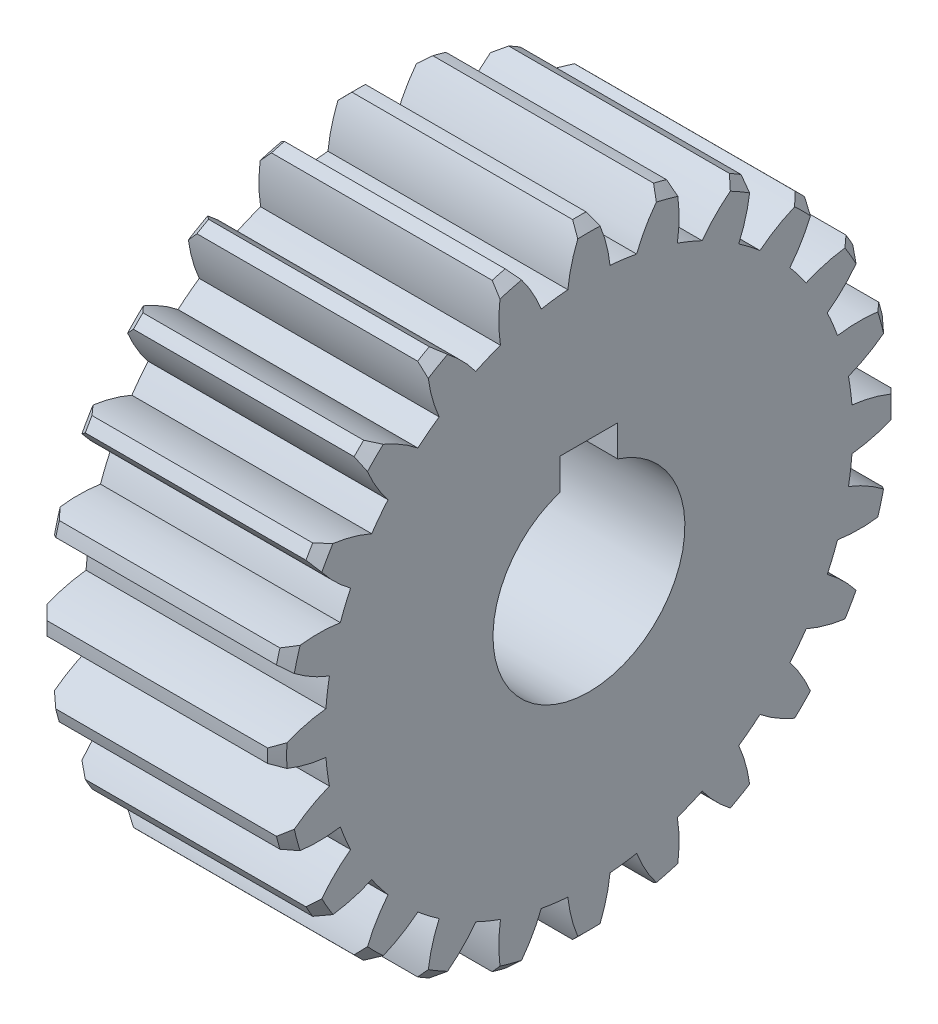
from build123d import *

# Parameters (mm, degrees)
SKETCH2_W          = 25
SKETCH2_H          = 22.5
CHAMFER1_SIZE      = 1
SKETCH3_W          = 6
SKETCH3_H          = 4.562916494
CUT_EXTRUDE1_DEPTH = 56


with BuildPart() as part:
    # Sketch2 → Revolve1 (revolve)
    with BuildSketch(Plane.XY, mode=Mode.PRIVATE) as revolve1_sk:
        with Locations((12.5, 21.25)):
            Rectangle(SKETCH2_W, SKETCH2_H)
    revolve(revolve1_sk.sketch.rotate(Axis((80.219330275, 0, 0), (-1, 0, 0)), 90), axis=Axis((80.219330275, 0, 0), (-1, 0, 0)))

    # Chamfer1
    chamfer1_edges = [part.edges().sort_by_distance(p)[0] for p in [
        (0, 0, 32.5),
        (25, 0, 32.5),
    ]]
    chamfer(chamfer1_edges, length=CHAMFER1_SIZE)

    # Sketch3 → Cut-Extrude1 (cut)
    with BuildSketch(Plane.ZY):
        with Locations((0, 10.518541753)):
            Rectangle(SKETCH3_W, SKETCH3_H)
        with BuildLine():
            ThreePointArc((9.08581572, 31.204133583), (9.38841269, 28.562236263), (9.219747923, 25.908420412))
            ThreePointArc((9.219747923, 25.908420412), (10.52379439, 25.406687144), (11.800673485, 24.83936604))
            ThreePointArc((11.800673485, 24.83936604), (13.55794067, 26.835161225), (15.640012549, 28.489296366))
            ThreePointArc((15.640012549, 28.489296366), (12.437211552, 30.026084807), (9.08581572, 31.204133583))
        make_face()
        with BuildLine():
            ThreePointArc((0.7, 32.492460664), (1.676059569, 30.01890167), (2.2, 27.411858748))
            ThreePointArc((2.2, 27.411858748), (3.589470286, 27.264733688), (4.969674288, 27.04722421))
            ThreePointArc((4.969674288, 27.04722421), (6.150514241, 29.429828538), (7.733519564, 31.566480247))
            ThreePointArc((7.733519564, 31.566480247), (4.242101247, 32.221957995), (0.7, 32.492460664))
        make_face()
        with BuildLine():
            ThreePointArc((16.852448115, 27.789296366), (16.460961, 25.159101656), (15.611185262, 22.63936604))
            ThreePointArc((15.611185262, 22.63936604), (16.740939298, 21.817216858), (17.827476287, 20.938746124))
            ThreePointArc((17.827476287, 20.938746124), (20.041415848, 22.411722022), (22.480664526, 23.47061402))
            ThreePointArc((22.480664526, 23.47061402), (19.784746443, 25.783983559), (16.852448115, 27.789296366))
        make_face()
        with BuildLine():
            ThreePointArc((23.47061402, 22.480664526), (22.411722022, 20.041415848), (20.938746124, 17.827476287))
            ThreePointArc((20.938746124, 17.827476287), (21.817216858, 16.740939298), (22.63936604, 15.611185262))
            ThreePointArc((22.63936604, 15.611185262), (25.159101656, 16.460961), (27.789296366, 16.852448115))
            ThreePointArc((27.789296366, 16.852448115), (25.783983559, 19.784746443), (23.47061402, 22.480664526))
        make_face()
        with BuildLine():
            ThreePointArc((28.489296366, 15.640012549), (26.835161225, 13.55794067), (24.83936604, 11.800673485))
            ThreePointArc((24.83936604, 11.800673485), (25.406687144, 10.52379439), (25.908420412, 9.219747923))
            ThreePointArc((25.908420412, 9.219747923), (28.562236263, 9.38841269), (31.204133583, 9.08581572))
            ThreePointArc((31.204133583, 9.08581572), (30.026084807, 12.437211552), (28.489296366, 15.640012549))
        make_face()
        with BuildLine():
            ThreePointArc((31.566480247, 7.733519564), (29.429828538, 6.150514241), (27.04722421, 4.969674288))
            ThreePointArc((27.04722421, 4.969674288), (27.264733688, 3.589470286), (27.411858748, 2.2))
            ThreePointArc((27.411858748, 2.2), (30.01890167, 1.676059569), (32.492460664, 0.7))
            ThreePointArc((32.492460664, 0.7), (32.221957995, 4.242101247), (31.566480247, 7.733519564))
        make_face()
        with BuildLine():
            ThreePointArc((32.492460664, -0.7), (30.01890167, -1.676059569), (27.411858748, -2.2))
            ThreePointArc((27.411858748, -2.2), (27.264733688, -3.589470286), (27.04722421, -4.969674288))
            ThreePointArc((27.04722421, -4.969674288), (29.429828538, -6.150514241), (31.566480247, -7.733519564))
            ThreePointArc((31.566480247, -7.733519564), (32.221957995, -4.242101247), (32.492460664, -0.7))
        make_face()
        with BuildLine():
            ThreePointArc((31.204133583, -9.08581572), (28.562236263, -9.38841269), (25.908420412, -9.219747923))
            ThreePointArc((25.908420412, -9.219747923), (25.406687144, -10.52379439), (24.83936604, -11.800673485))
            ThreePointArc((24.83936604, -11.800673485), (26.835161225, -13.55794067), (28.489296366, -15.640012549))
            ThreePointArc((28.489296366, -15.640012549), (30.026084807, -12.437211552), (31.204133583, -9.08581572))
        make_face()
        with BuildLine():
            ThreePointArc((27.789296366, -16.852448115), (25.159101656, -16.460961), (22.63936604, -15.611185262))
            ThreePointArc((22.63936604, -15.611185262), (21.817216858, -16.740939298), (20.938746124, -17.827476287))
            ThreePointArc((20.938746124, -17.827476287), (22.411722022, -20.041415848), (23.47061402, -22.480664526))
            ThreePointArc((23.47061402, -22.480664526), (25.783983559, -19.784746443), (27.789296366, -16.852448115))
        make_face()
        with BuildLine():
            ThreePointArc((22.480664526, -23.47061402), (20.041415848, -22.411722022), (17.827476287, -20.938746124))
            ThreePointArc((17.827476287, -20.938746124), (16.740939298, -21.817216858), (15.611185262, -22.63936604))
            ThreePointArc((15.611185262, -22.63936604), (16.460961, -25.159101656), (16.852448115, -27.789296366))
            ThreePointArc((16.852448115, -27.789296366), (19.784746443, -25.783983559), (22.480664526, -23.47061402))
        make_face()
        with BuildLine():
            ThreePointArc((15.640012549, -28.489296366), (13.55794067, -26.835161225), (11.800673485, -24.83936604))
            ThreePointArc((11.800673485, -24.83936604), (10.52379439, -25.406687144), (9.219747923, -25.908420412))
            ThreePointArc((9.219747923, -25.908420412), (9.38841269, -28.562236263), (9.08581572, -31.204133583))
            ThreePointArc((9.08581572, -31.204133583), (12.437211552, -30.026084807), (15.640012549, -28.489296366))
        make_face()
        with BuildLine():
            ThreePointArc((7.733519564, -31.566480247), (6.150514241, -29.429828538), (4.969674288, -27.04722421))
            ThreePointArc((4.969674288, -27.04722421), (3.589470286, -27.264733688), (2.2, -27.411858748))
            ThreePointArc((2.2, -27.411858748), (1.676059569, -30.01890167), (0.7, -32.492460664))
            ThreePointArc((0.7, -32.492460664), (4.242101247, -32.221957995), (7.733519564, -31.566480247))
        make_face()
        with BuildLine():
            ThreePointArc((-0.7, -32.492460664), (-1.676059569, -30.01890167), (-2.2, -27.411858748))
            ThreePointArc((-2.2, -27.411858748), (-3.589470286, -27.264733688), (-4.969674288, -27.04722421))
            ThreePointArc((-4.969674288, -27.04722421), (-6.150514241, -29.429828538), (-7.733519564, -31.566480247))
            ThreePointArc((-7.733519564, -31.566480247), (-4.242101247, -32.221957995), (-0.7, -32.492460664))
        make_face()
        with BuildLine():
            ThreePointArc((-9.08581572, -31.204133583), (-9.38841269, -28.562236263), (-9.219747923, -25.908420412))
            ThreePointArc((-9.219747923, -25.908420412), (-10.52379439, -25.406687144), (-11.800673485, -24.83936604))
            ThreePointArc((-11.800673485, -24.83936604), (-13.55794067, -26.835161225), (-15.640012549, -28.489296366))
            ThreePointArc((-15.640012549, -28.489296366), (-12.437211552, -30.026084807), (-9.08581572, -31.204133583))
        make_face()
        with BuildLine():
            ThreePointArc((-16.852448115, -27.789296366), (-16.460961, -25.159101656), (-15.611185262, -22.63936604))
            ThreePointArc((-15.611185262, -22.63936604), (-16.740939298, -21.817216858), (-17.827476287, -20.938746124))
            ThreePointArc((-17.827476287, -20.938746124), (-20.041415848, -22.411722022), (-22.480664526, -23.47061402))
            ThreePointArc((-22.480664526, -23.47061402), (-19.784746443, -25.783983559), (-16.852448115, -27.789296366))
        make_face()
        with BuildLine():
            ThreePointArc((-23.47061402, -22.480664526), (-22.411722022, -20.041415848), (-20.938746124, -17.827476287))
            ThreePointArc((-20.938746124, -17.827476287), (-21.817216858, -16.740939298), (-22.63936604, -15.611185262))
            ThreePointArc((-22.63936604, -15.611185262), (-25.159101656, -16.460961), (-27.789296366, -16.852448115))
            ThreePointArc((-27.789296366, -16.852448115), (-25.783983559, -19.784746443), (-23.47061402, -22.480664526))
        make_face()
        with BuildLine():
            ThreePointArc((-28.489296366, -15.640012549), (-26.835161225, -13.55794067), (-24.83936604, -11.800673485))
            ThreePointArc((-24.83936604, -11.800673485), (-25.406687144, -10.52379439), (-25.908420412, -9.219747923))
            ThreePointArc((-25.908420412, -9.219747923), (-28.562236263, -9.38841269), (-31.204133583, -9.08581572))
            ThreePointArc((-31.204133583, -9.08581572), (-30.026084807, -12.437211552), (-28.489296366, -15.640012549))
        make_face()
        with BuildLine():
            ThreePointArc((-31.566480247, -7.733519564), (-29.429828538, -6.150514241), (-27.04722421, -4.969674288))
            ThreePointArc((-27.04722421, -4.969674288), (-27.264733688, -3.589470286), (-27.411858748, -2.2))
            ThreePointArc((-27.411858748, -2.2), (-30.01890167, -1.676059569), (-32.492460664, -0.7))
            ThreePointArc((-32.492460664, -0.7), (-32.221957995, -4.242101247), (-31.566480247, -7.733519564))
        make_face()
        with BuildLine():
            ThreePointArc((-32.492460664, 0.7), (-30.01890167, 1.676059569), (-27.411858748, 2.2))
            ThreePointArc((-27.411858748, 2.2), (-27.264733688, 3.589470286), (-27.04722421, 4.969674288))
            ThreePointArc((-27.04722421, 4.969674288), (-29.429828538, 6.150514241), (-31.566480247, 7.733519564))
            ThreePointArc((-31.566480247, 7.733519564), (-32.221957995, 4.242101247), (-32.492460664, 0.7))
        make_face()
        with BuildLine():
            ThreePointArc((-31.204133583, 9.08581572), (-28.562236263, 9.38841269), (-25.908420412, 9.219747923))
            ThreePointArc((-25.908420412, 9.219747923), (-25.406687144, 10.52379439), (-24.83936604, 11.800673485))
            ThreePointArc((-24.83936604, 11.800673485), (-26.835161225, 13.55794067), (-28.489296366, 15.640012549))
            ThreePointArc((-28.489296366, 15.640012549), (-30.026084807, 12.437211552), (-31.204133583, 9.08581572))
        make_face()
        with BuildLine():
            ThreePointArc((-27.789296366, 16.852448115), (-25.159101656, 16.460961), (-22.63936604, 15.611185262))
            ThreePointArc((-22.63936604, 15.611185262), (-21.817216858, 16.740939298), (-20.938746124, 17.827476287))
            ThreePointArc((-20.938746124, 17.827476287), (-22.411722022, 20.041415848), (-23.47061402, 22.480664526))
            ThreePointArc((-23.47061402, 22.480664526), (-25.783983559, 19.784746443), (-27.789296366, 16.852448115))
        make_face()
        with BuildLine():
            ThreePointArc((-22.480664526, 23.47061402), (-20.041415848, 22.411722022), (-17.827476287, 20.938746124))
            ThreePointArc((-17.827476287, 20.938746124), (-16.740939298, 21.817216858), (-15.611185262, 22.63936604))
            ThreePointArc((-15.611185262, 22.63936604), (-16.460961, 25.159101656), (-16.852448115, 27.789296366))
            ThreePointArc((-16.852448115, 27.789296366), (-19.784746443, 25.783983559), (-22.480664526, 23.47061402))
        make_face()
        with BuildLine():
            ThreePointArc((-15.640012549, 28.489296366), (-13.55794067, 26.835161225), (-11.800673485, 24.83936604))
            ThreePointArc((-11.800673485, 24.83936604), (-10.52379439, 25.406687144), (-9.219747923, 25.908420412))
            ThreePointArc((-9.219747923, 25.908420412), (-9.38841269, 28.562236263), (-9.08581572, 31.204133583))
            ThreePointArc((-9.08581572, 31.204133583), (-12.437211552, 30.026084807), (-15.640012549, 28.489296366))
        make_face()
        with BuildLine():
            ThreePointArc((-7.733519564, 31.566480247), (-6.150514241, 29.429828538), (-4.969674288, 27.04722421))
            ThreePointArc((-4.969674288, 27.04722421), (-3.589470286, 27.264733688), (-2.2, 27.411858748))
            ThreePointArc((-2.2, 27.411858748), (-1.676059569, 30.01890167), (-0.7, 32.492460664))
            ThreePointArc((-0.7, 32.492460664), (-4.242101247, 32.221957995), (-7.733519564, 31.566480247))
        make_face()
    extrude(amount=-CUT_EXTRUDE1_DEPTH, mode=Mode.SUBTRACT)


solid = part.part
